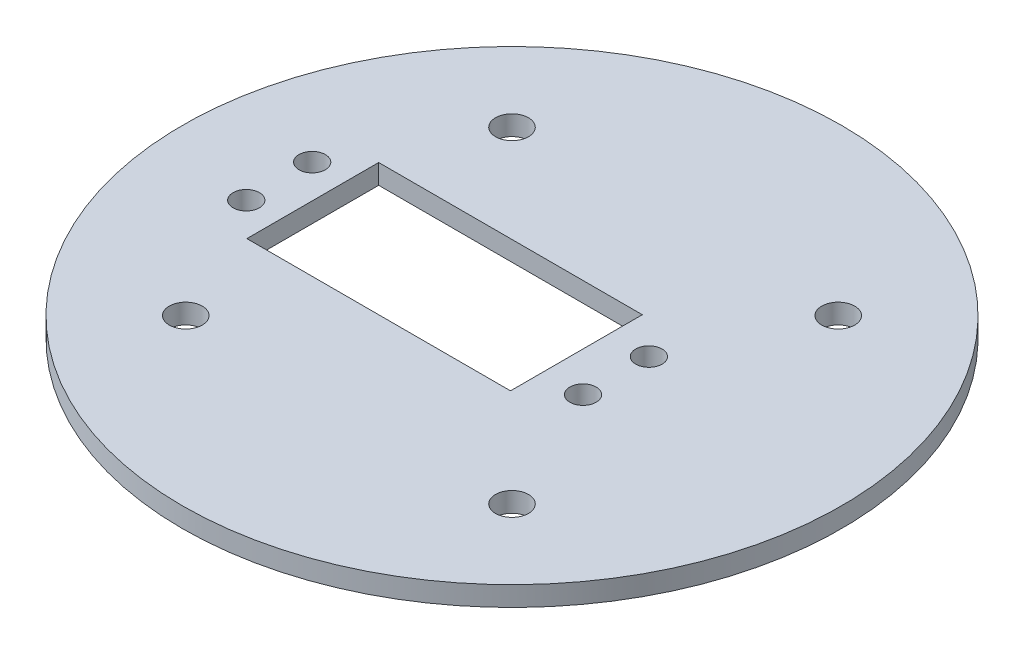
from build123d import *

# Parameters (mm, degrees)
SKETCH2_R           = 50
SKETCH2_R_2         = 2.5
SKETCH2_R_3         = 2
BOSS_EXTRUDE1_DEPTH = 3


with BuildPart() as part:
    # Sketch2 → Boss-Extrude1 (new body)
    with BuildSketch(Plane(origin=(0, 0, 0), x_dir=(1, 0, 0), z_dir=(0, 1, 0))):
        with Locations(Location((0, 0, 0), (0, 0, 270))):
            Circle(SKETCH2_R)
        with Locations(Location((-24.748737342, 24.748737342, 0), (0, 0, 270))):
            Circle(SKETCH2_R_2, mode=Mode.SUBTRACT)
        with Locations(Location((24.748737342, 24.748737342, 0), (0, 0, 270))):
            Circle(SKETCH2_R_2, mode=Mode.SUBTRACT)
        with Locations(Location((24.748737342, -24.748737342, 0), (0, 0, 270))):
            Circle(SKETCH2_R_2, mode=Mode.SUBTRACT)
        with Locations(Location((-24.748737342, -24.748737342, 0), (0, 0, 270))):
            Circle(SKETCH2_R_2, mode=Mode.SUBTRACT)
        with Locations(Location((15.772078615, 5, 0), (0, 0, 270))):
            Circle(SKETCH2_R_3, mode=Mode.SUBTRACT)
        with Locations(Location((15.772078615, -5, 0), (0, 0, 90))):
            Circle(SKETCH2_R_3, mode=Mode.SUBTRACT)
        with Locations(Location((-35.316235845, -5, 0), (0, 0, 270))):
            Circle(SKETCH2_R_3, mode=Mode.SUBTRACT)
        with Locations(Location((-35.316235845, 5, 0), (0, 0, 90))):
            Circle(SKETCH2_R_3, mode=Mode.SUBTRACT)
        Polygon((-9.772078615, -10), (9.772078615, -10), (9.772078615, 10), (-9.772078615, 10), (-30.227921385, 10), (-30.227921385, -10), align=None, mode=Mode.SUBTRACT)
    extrude(amount=BOSS_EXTRUDE1_DEPTH)


solid = part.part
